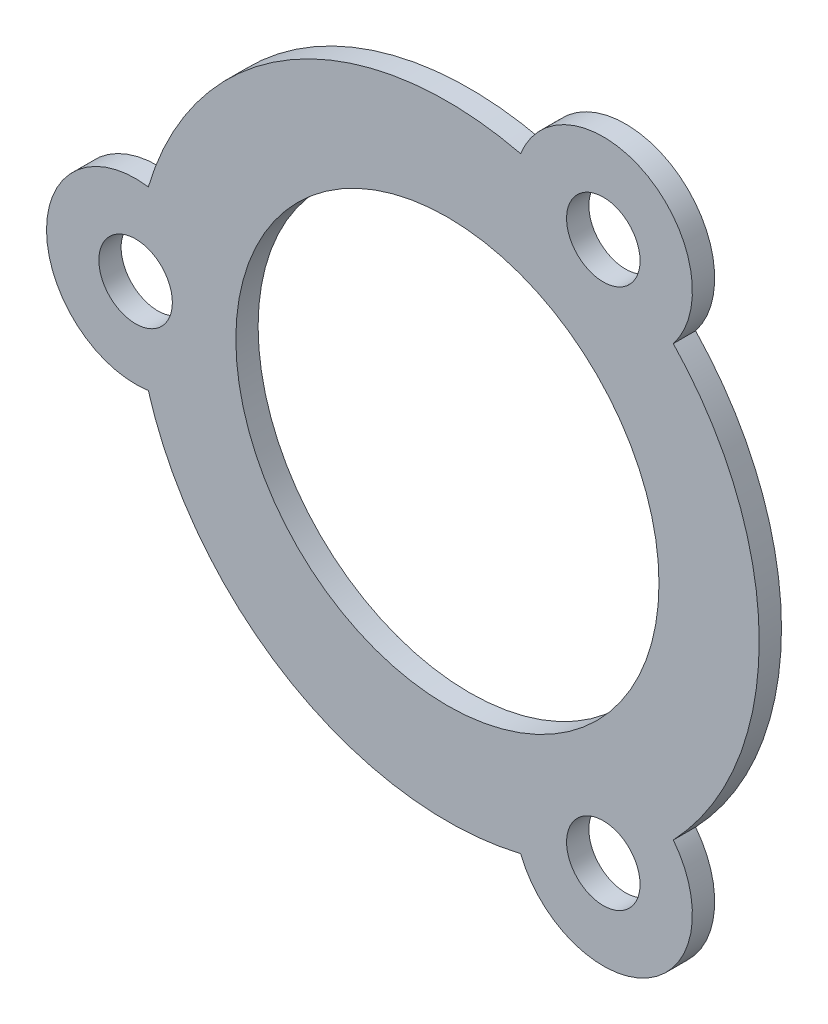
from build123d import *

# Parameters (mm, degrees)
SKETCH1_R           = 1.65
SKETCH1_R_2         = 9.5
BOSS_EXTRUDE1_DEPTH = 1


with BuildPart() as part:
    # Sketch1 → Boss-Extrude1 (new body)
    with BuildSketch(Plane.XY):
        with BuildLine():
            ThreePointArc((10.142857143, 9.649997356), (9, 15.588457268), (3.285714286, 13.608970631))
            ThreePointArc((3.285714286, 13.608970631), (-7, 12.124355653), (-13.428571429, 3.958973274))
            ThreePointArc((-13.428571429, 3.958973274), (-18, 0), (-13.428571429, -3.958973274))
            ThreePointArc((-13.428571429, -3.958973274), (-7, -12.124355653), (3.285714286, -13.608970631))
            ThreePointArc((3.285714286, -13.608970631), (9, -15.588457268), (10.142857143, -9.649997356))
            ThreePointArc((10.142857143, -9.649997356), (14, 0), (10.142857143, 9.649997356))
        make_face()
        with Locations((7, 12.124355653)):
            Circle(SKETCH1_R, mode=Mode.SUBTRACT)
        with Locations((7, -12.124355653)):
            Circle(SKETCH1_R, mode=Mode.SUBTRACT)
        with Locations((-14, 0)):
            Circle(SKETCH1_R, mode=Mode.SUBTRACT)
        Circle(SKETCH1_R_2, mode=Mode.SUBTRACT)
    extrude(amount=BOSS_EXTRUDE1_DEPTH)


solid = part.part
